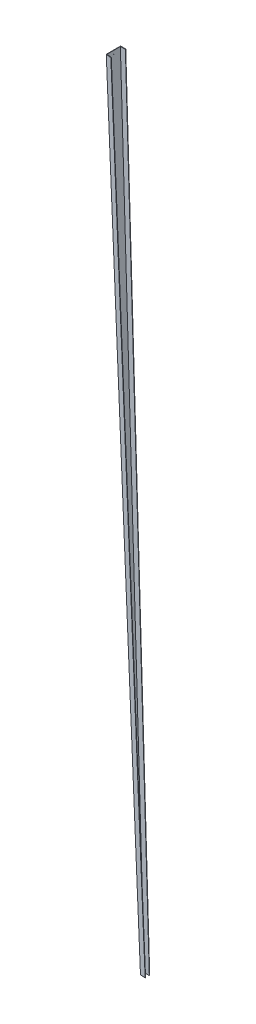
from build123d import *

# Parameters (mm, degrees)
BOSS_EXTRUDE1_DEPTH       = 6
BOSS_EXTRUDE2_DEPTH       = 6
F_4_0MM_DOWEL_HOLE1_D     = 4
F_4_0MM_DOWEL_HOLE1_DEPTH = 691.055627624


with BuildPart() as part:
    # Sketch1 → Boss-Extrude1 (new body)
    with BuildSketch(Plane(origin=(0, 0, 0), x_dir=(1, 0, 0), z_dir=(0, 1, 0))):
        with BuildLine():
            add(Edge.make_bspline(
                [(600, 89.46459172), (602.959954579, 89.484565354), (636.288713828, 89.692302977), (669.6237834, 89.714357551), (700, 89.613057684)],
                knots=[0.57911038, 0.57911038, 0.57911038, 0.57911038, 0.580209466, 0.591485786, 0.591485786, 0.591485786, 0.591485786], degree=3))
            Line((600, 89.46459172), (600, -186.184281919))
            add(Edge.make_bspline(
                [(699.325355788, -197.780561394), (666.175999226, -194.262835331), (633.063278118, -190.410650527), (600, -186.184281919)],
                knots=[0.410156143, 0.410156143, 0.410156143, 0.410156143, 0.422530239, 0.422530239, 0.422530239, 0.422530239], degree=3))
            Line((699.325355788, -197.780561394), (700.169555672, -189.82522818))
            Line((700.169555672, -189.82522818), (603.999995587, -178.649131078))
            Line((603.999995587, -178.649131078), (603.999995587, 81.470533717))
            Line((603.999995587, 81.470533717), (699.973321417, 81.613102169))
            Line((699.973321417, 81.613102169), (700, 89.613057684))
        make_face()
    extrude(amount=-BOSS_EXTRUDE1_DEPTH)



with BuildPart() as body_2:
    # Sketch2 → Boss-Extrude2 (new body)
    with BuildSketch(Plane(origin=(0, -15000, 0), x_dir=(1, 0, 0), z_dir=(0, 1, 0))):
        with BuildLine():
            Line((1387.360193502, -144.900282568), (1387.497467773, -136.901460418))
            add(Edge.make_bspline(
                [(1287.5, -136.189815087), (1288.424985806, -136.183573327), (1310.049834391, -136.048785988), (1343.389593971, -136.226565365), (1375.794996952, -136.700624831), (1387.497467773, -136.901460418)],
                knots=[0.57911038, 0.57911038, 0.57911038, 0.57911038, 0.580209466, 0.604805069, 0.618709183, 0.618709183, 0.618709183, 0.618709183], degree=3))
            Line((1287.5, -136.189815087), (1287.5, -215.4550881))
            add(Edge.make_bspline(
                [(1387.048556653, -224.93727991), (1373.893130502, -224.064248291), (1340.651757958, -221.513080746), (1307.489329718, -218.010257468), (1287.5, -215.4550881)],
                knots=[0.382928957, 0.382928957, 0.382928957, 0.382928957, 0.398590699, 0.422530239, 0.422530239, 0.422530239, 0.422530239], degree=3))
            Line((1387.048556653, -224.93727991), (1387.576309659, -216.984743553))
            Line((1387.576309659, -216.984743553), (1291.5, -207.835983658))
            Line((1291.5, -207.835983658), (1291.5, -144.218273573))
            Line((1291.5, -144.218273573), (1387.360193502, -144.900282568))
        make_face()
    extrude(amount=BOSS_EXTRUDE2_DEPTH)


with BuildPart() as part_1:
    add(part.part)

    add(body_2.part)  # loft1 joins it to this body
    # loft from a face of the part (loft1)
    loft([part_1.faces().sort_by_distance((600.955915883, -6, 48.589298681))[0], part_1.faces().sort_by_distance((1385.977348347, -14994, 220.872411694))[0]])

    # Ø4.0mm Dowel Hole1
    with Locations(Plane(origin=(604.759954203, -22.567650438, -62.95369296), x_dir=(-0.04582184903055539, 0.9989496274344474, 0), z_dir=(0.9989496274344474, 0.04582184903055539, 1.045988805960479e-14))):
        with Locations((-43.414815533, 111.659709576), (-43.414815533, 151.659709576), (-43.414815533, 191.659709576), (-43.414815533, 71.659709576), (-43.414815533, 31.659709576)):
            Hole(F_4_0MM_DOWEL_HOLE1_D / 2, depth=F_4_0MM_DOWEL_HOLE1_DEPTH)


solid = part_1.part
